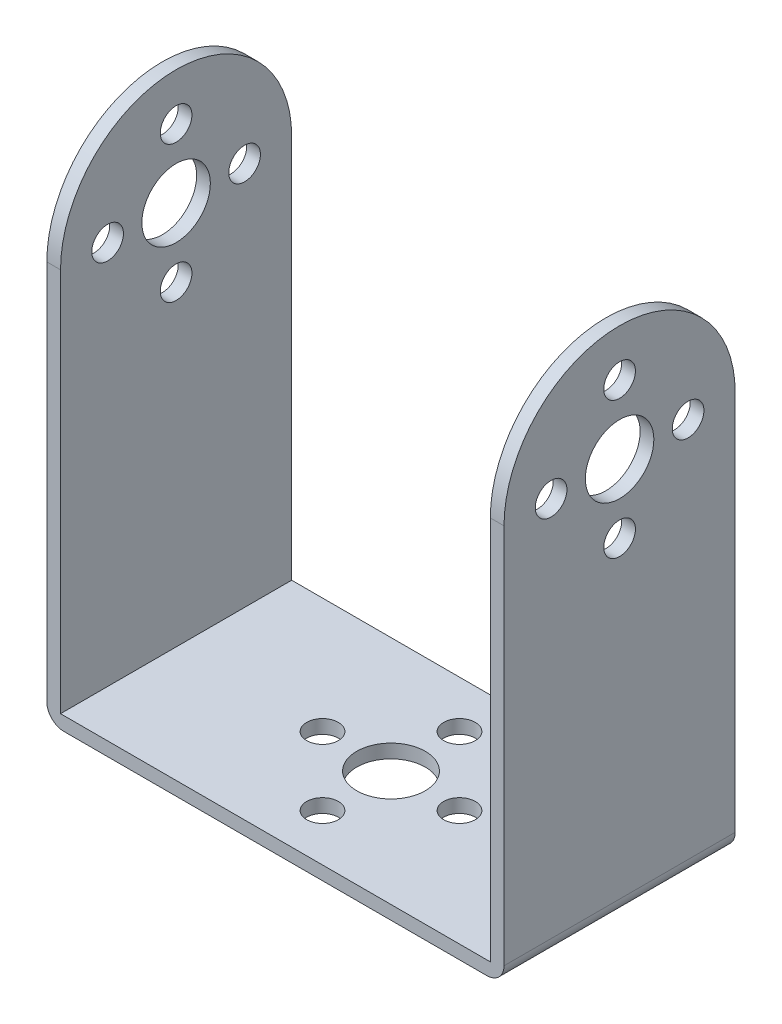
from build123d import *

# Parameters (mm, degrees)
BOSS_EXTRUDE1_DEPTH = 13.5
FILLET1_RADIUS      = 13.5
FILLET1_LENGTH      = 1.6
FILLET2_RADIUS      = 13.5
FILLET2_LENGTH      = 1.6
SKETCH3_R           = 4
SKETCH3_R_2         = 1.85
CUT_EXTRUDE1_DEPTH  = 82.4482044
SKETCH4_R           = 4
SKETCH4_R_2         = 1.85
CUT_EXTRUDE2_DEPTH  = 27
FILLET6_R           = 2
FILLET7_R           = 2


with BuildPart() as part:
    # Sketch1 → Boss-Extrude1 (new, symmetric)
    with BuildSketch(Plane.XY):
        Polygon((-26.7, 0), (26.7, 0), (26.7, 60), (25.1, 60), (25.1, 1.6), (-25.1, 1.6), (-25.1, 60), (-26.7, 60), align=None)
    extrude(amount=BOSS_EXTRUDE1_DEPTH, both=True)

    # Fillet1: full round fillet: the end face becomes a half cylinder, R = half its width
    fillet1_face = Plane((25.9, 60, 0), x_dir=(-1, 0, 0), z_dir=(0, 1, 0))  # on the end face: x along it, z out of the body
    fillet1_slab = fillet1_face.offset(-FILLET1_RADIUS / 2) * Box(FILLET1_LENGTH, 2 * FILLET1_RADIUS, FILLET1_RADIUS, mode=Mode.PRIVATE)  # the body's end, R deep
    fillet1_round = Plane((25.9, 46.5, 0), x_dir=(0, 1, 0), z_dir=(-1, 0, 0)) * Cylinder(FILLET1_RADIUS, FILLET1_LENGTH, mode=Mode.PRIVATE)  # its axis R under the face
    add(fillet1_slab - fillet1_round, mode=Mode.SUBTRACT)

    # Fillet2: full round fillet: the end face becomes a half cylinder, R = half its width
    fillet2_face = Plane((-25.9, 60, 0), x_dir=(-1, 0, 0), z_dir=(0, 1, 0))  # on the end face: x along it, z out of the body
    fillet2_slab = fillet2_face.offset(-FILLET2_RADIUS / 2) * Box(FILLET2_LENGTH, 2 * FILLET2_RADIUS, FILLET2_RADIUS, mode=Mode.PRIVATE)  # the body's end, R deep
    fillet2_round = Plane((-25.9, 46.5, 0), x_dir=(0, 1, 0), z_dir=(-1, 0, 0)) * Cylinder(FILLET2_RADIUS, FILLET2_LENGTH, mode=Mode.PRIVATE)  # its axis R under the face
    add(fillet2_slab - fillet2_round, mode=Mode.SUBTRACT)

    # Sketch3 → Cut-Extrude1 (cut, through all)
    with BuildSketch(Plane(origin=(26.7, 0, 0), x_dir=(0, 0, -1), z_dir=(1, 0, 0))):
        with Locations((0, 46.5)):
            Circle(SKETCH3_R)
        with Locations((8, 46.5)):
            Circle(SKETCH3_R_2)
        with Locations((-8, 46.5)):
            Circle(SKETCH3_R_2)
        with Locations((0, 38.5)):
            Circle(SKETCH3_R_2)
        with Locations((0, 54.5)):
            Circle(SKETCH3_R_2)
    extrude(amount=-CUT_EXTRUDE1_DEPTH, mode=Mode.SUBTRACT)

    # Sketch4 → Cut-Extrude2 (cut)
    with BuildSketch(Plane.XZ):
        with Locations(Location((0, 0, 0), (0, 0, 270))):
            Circle(SKETCH4_R)
        with Locations(Location((8, 0, 0), (0, 0, 270))):
            Circle(SKETCH4_R_2)
        with Locations(Location((-8, 0, 0), (0, 0, 270))):
            Circle(SKETCH4_R_2)
        with Locations(Location((0, -8, 0), (0, 0, 270))):
            Circle(SKETCH4_R_2)
        with Locations(Location((0, 8, 0), (0, 0, 270))):
            Circle(SKETCH4_R_2)
    extrude(amount=-CUT_EXTRUDE2_DEPTH, mode=Mode.SUBTRACT)

    # Fillet6
    fillet6_edges = [part.edges().sort_by_distance(p)[0] for p in [
        (26.7, 0, 0),
    ]]
    fillet(fillet6_edges, radius=FILLET6_R)

    # Fillet7
    fillet7_edges = [part.edges().sort_by_distance(p)[0] for p in [
        (-26.7, 0, 0),
    ]]
    fillet(fillet7_edges, radius=FILLET7_R)


solid = part.part
